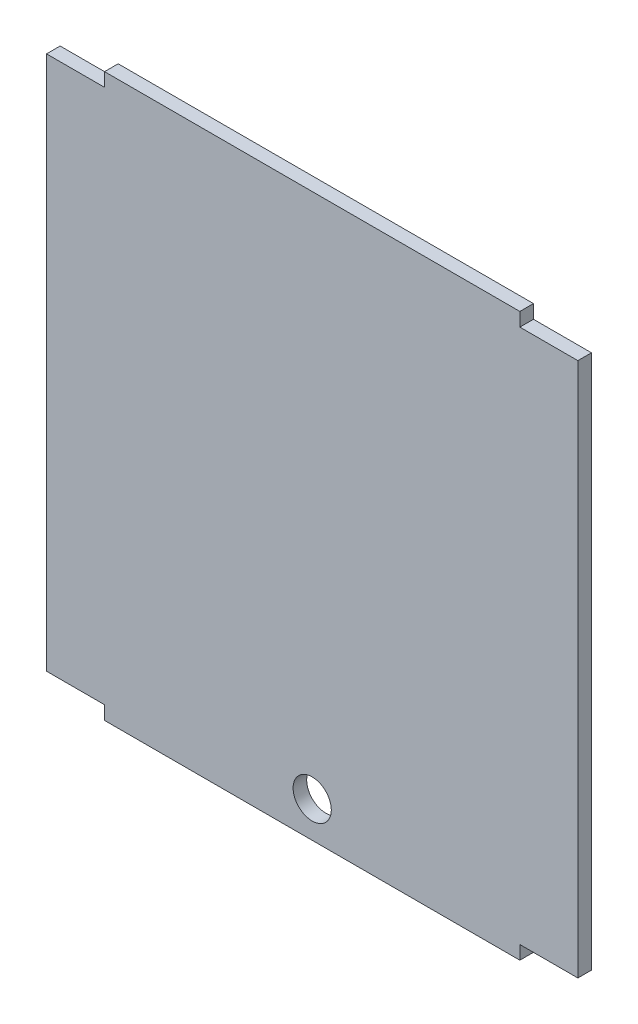
from build123d import *

# Parameters (mm, degrees)
BOSS_EXTRUDE1_DEPTH = 5.7
SKETCH3_R           = 8
CUT_EXTRUDE1_DEPTH  = 5.7


with BuildPart() as part:
    # Sketch2 → Boss-Extrude1 (new body)
    with BuildSketch(Plane.XY):
        Polygon((198.3, 224), (222.6, 224), (222.6, 0), (198.3, 0), (198.3, -5.7), (24.3, -5.7), (24.3, 0), (0, 0), (0, 224), (24.3, 224), (24.3, 229.7), (198.3, 229.7), align=None)
    extrude(amount=BOSS_EXTRUDE1_DEPTH)

    # Sketch3 → Cut-Extrude1 (cut)
    with BuildSketch(Plane.XY.offset(5.7)):
        with Locations((111.3, 9.3)):
            Circle(SKETCH3_R)
    extrude(amount=-CUT_EXTRUDE1_DEPTH, mode=Mode.SUBTRACT)


solid = part.part
